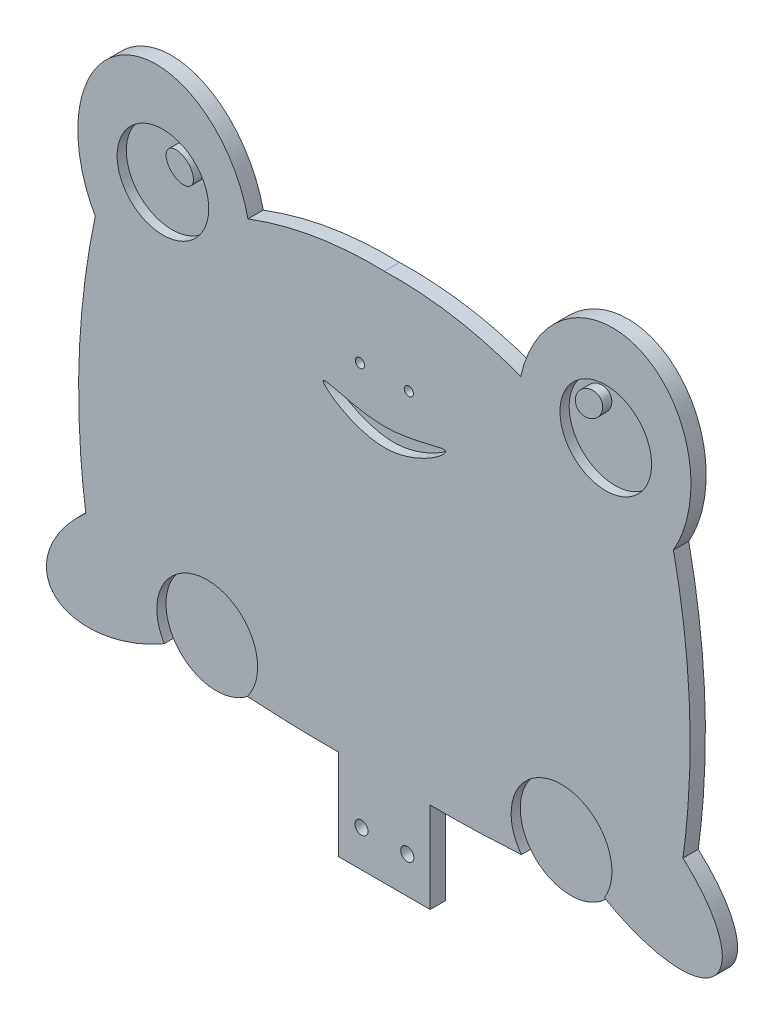
from build123d import *

# Parameters (mm, degrees)
BOSS_EXTRUDE1_DEPTH = 5
SKETCH6_R           = 15
SKETCH6_RX          = 5
SKETCH6_RY          = 3.75
CUT_EXTRUDE1_DEPTH  = 3
SKETCH8_R           = 1.5
CUT_EXTRUDE2_DEPTH  = 3
CUT_EXTRUDE3_START  = -3
SKETCH9_R           = 16.5
CUT_EXTRUDE3_DEPTH  = 3
SKETCH11_R          = 2.15
CUT_EXTRUDE4_DEPTH  = 148.564868374


with BuildPart() as part:
    # Sketch5 → Boss-Extrude1 (new body)
    with BuildSketch(Plane.XY):
        with BuildLine():
            ThreePointArc((44.868666826, -66.990900314), (58.820435167, -73.479589987), (72.058734001, -65.637244833))
            add(Edge.make_bspline(
                [(72.058734001, -65.637244833), (100.497288533, -82.258399283), (109.237780195, -68.273612622)],
                knots=[4.771708327, 4.771708327, 4.771708327, 6.283185307, 6.283185307, 6.283185307], degree=2, weights=[1, 0.727765266, 1]))
            add(Edge.make_bspline(
                [(109.237780195, -68.273612622), (115.914883578, -57.59024721), (97.770848906, -41.536315859)],
                knots=[0, 0, 0, 1.247920665, 1.247920665, 1.247920665], degree=2, weights=[1, 0.811570988, 1]))
            add(Edge.make_bspline(
                [(94.660066817, 44.292284267), (103.689591341, 1.46870769), (97.770848906, -41.536315859)],
                knots=[0, 0, 0, 0.80411055, 0.80411055, 0.80411055], degree=2))
            add(Edge.make_bspline(
                [(94.660066817, 44.292284267), (115.285000999, 80.21369332), (84.535330754, 95.110868429), (53.785660508, 110.008043537), (44.654436947, 68.518320471)],
                knots=[1.194802236, 1.194802236, 1.194802236, 2.953595608, 2.953595608, 4.71238898, 4.71238898, 4.71238898], degree=2, weights=[1, 0.637616026, 1, 0.637616026, 1]))
            add(Edge.make_bspline(
                [(44.654436947, 68.518320471), (23.094164868, 76.659000968), (0, 76)],
                knots=[0, 0, 0, 1, 1, 1], degree=2))
            add(Edge.make_bspline(
                [(-44.654436947, 68.518320471), (-23.094164868, 76.659000968), (0, 76)],
                knots=[0, 0, 0, 1, 1, 1], degree=2))
            add(Edge.make_bspline(
                [(-44.654436947, 68.518320471), (-53.785660508, 110.008043537), (-84.535330754, 95.110868429), (-115.285000999, 80.21369332), (-94.660066817, 44.292284267)],
                knots=[1.570796327, 1.570796327, 1.570796327, 3.329589699, 3.329589699, 5.088383072, 5.088383072, 5.088383072], degree=2, weights=[1, 0.637616026, 1, 0.637616026, 1]))
            add(Edge.make_bspline(
                [(-94.660066817, 44.292284267), (-103.689591341, 1.46870769), (-97.770848906, -41.536315859)],
                knots=[0, 0, 0, 0.80411055, 0.80411055, 0.80411055], degree=2))
            add(Edge.make_bspline(
                [(-97.770848906, -41.536315859), (-118.565729908, -59.935729115), (-107.761744086, -70.062709953), (-96.957758264, -80.18969079), (-72.058734001, -65.637244833)],
                knots=[1.893671989, 1.893671989, 1.893671989, 3.273370811, 3.273370811, 4.653069634, 4.653069634, 4.653069634], degree=2, weights=[1, 0.771341862, 1, 0.771341862, 1]))
            ThreePointArc((-72.058734001, -65.637244833), (-58.820435167, -73.479589987), (-44.868666826, -66.990900314))
            add(Edge.make_bspline(
                [(-44.868666826, -66.990900314), (-29.951897254, -67.96001433), (-15, -67.863977533)],
                knots=[0.362238568, 0.362238568, 0.362238568, 0.787040909, 0.787040909, 0.787040909], degree=2))
            Line((-15, -67.863977533), (-15, -97.5))
            Line((-15, -97.5), (15, -97.5))
            Line((15, -97.5), (15, -67.863977533))
            add(Edge.make_bspline(
                [(15, -67.863977533), (29.951897254, -67.96001433), (44.868666826, -66.990900314)],
                knots=[1, 1, 1, 1.424802341, 1.424802341, 1.424802341], degree=2))
        make_face()
    extrude(amount=BOSS_EXTRUDE1_DEPTH)

    # Sketch6 → Cut-Extrude1 (cut)
    # profile 1 of 2: a face of its own
    with BuildSketch(Plane.XY.offset(5)):
        with Locations((-72.5, 65)):
            Circle(SKETCH6_R)
        with Locations(Location((-67, 72), (0, 0, -42.5))):
            Ellipse(SKETCH6_RX, SKETCH6_RY, mode=Mode.SUBTRACT)
    # profile 2 of 2: a face of its own
    with BuildSketch(Plane.XY.offset(5)):
        with Locations(Location((72.5, 65, 0), (0, 0, 180))):
            Circle(SKETCH6_R)
        with Locations(Location((67, 72), (0, 0, -137.5))):
            Ellipse(SKETCH6_RX, SKETCH6_RY, mode=Mode.SUBTRACT)
    extrude(amount=-CUT_EXTRUDE1_DEPTH, mode=Mode.SUBTRACT)

    # Sketch8 → Cut-Extrude2 (cut)
    with BuildSketch(Plane.XY.offset(5)):
        with Locations((-8, 46)):
            Circle(SKETCH8_R)
        with Locations((8, 46)):
            Circle(SKETCH8_R)
        with BuildLine():
            add(Edge.make_bspline(
                [(-20, 35), (-19.480823699, 36.210329753), (0, 27.789670247), (30.04384619, 40.776236057), (0, 18.312546183), (-20.563022492, 33.687453817), (-20, 35)],
                knots=[0, 0, 0, 0, 0.239871041, 0.479742081, 0.739871041, 1, 1, 1, 1], degree=3))
        make_face()
    extrude(amount=-CUT_EXTRUDE2_DEPTH, mode=Mode.SUBTRACT)

    # Sketch9 → Cut-Extrude3 (cut)
    with BuildSketch(Plane.XY.offset(5).offset(CUT_EXTRUDE3_START)):
        with Locations((-58, -57)):
            Circle(SKETCH9_R)
        with Locations((58, -57)):
            Circle(SKETCH9_R)
    extrude(amount=CUT_EXTRUDE3_DEPTH, mode=Mode.SUBTRACT)

    # Sketch11 → Cut-Extrude4 (cut, through all)
    with BuildSketch(Plane.XY.offset(5)):
        with Locations((-7.5, -85.5)):
            Circle(SKETCH11_R)
        with Locations((7.5, -85.5)):
            Circle(SKETCH11_R)
    extrude(amount=-CUT_EXTRUDE4_DEPTH, mode=Mode.SUBTRACT)


solid = part.part
